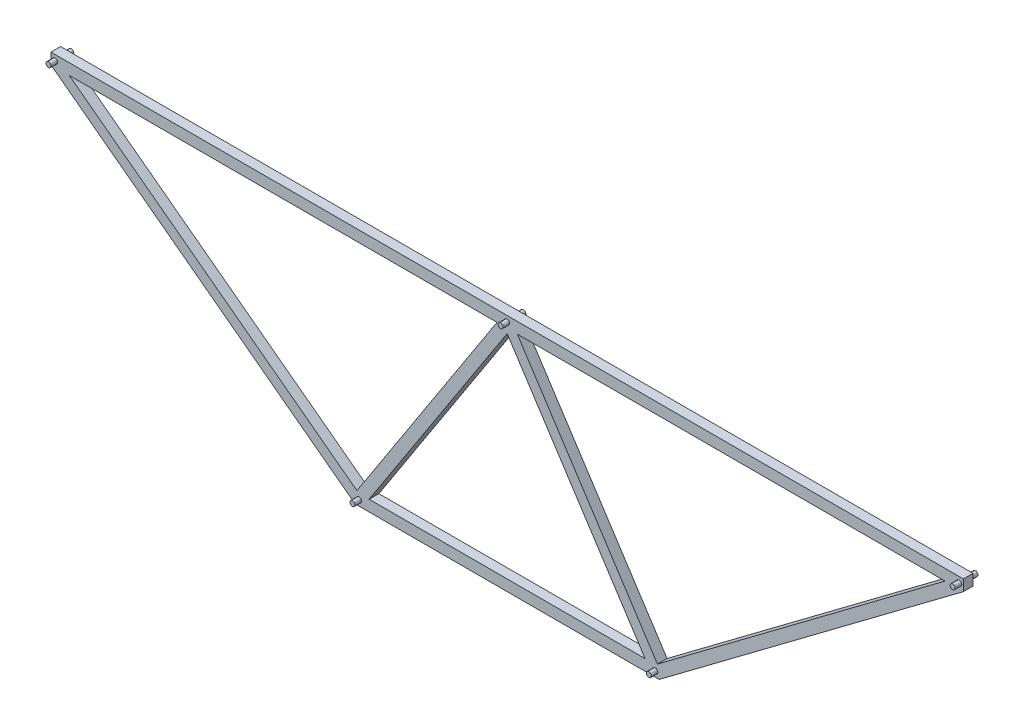
from build123d import *

# Parameters (mm, degrees)
BOSS_EXTRUDE2_DEPTH = 6.375
SKETCH3_R           = 3.3
BOSS_EXTRUDE3_DEPTH = 14.975


with BuildPart() as part:
    # Sketch1 → Boss-Extrude2 (new, symmetric)
    with BuildSketch(Plane.XY):
        Polygon((0, -7.245), (0, 0), (-600, 0), (-600, -14.49), (-591.306, -2.898), (-575.85, -14.49), (-13.344393946, -14.49), (-6.075978819, -3.298798486), align=None)
        Polygon((0, -20.546405114), (-3.933488865, -14.49), (-13.344393946, -14.49), (-197.595006689, -298.181244983), (-195.17, -300), (-181.498361341, -300), align=None)
        Polygon((-575.85, -14.49), (-600, -14.49), (-200, -314.49), (-200, -307.806399497), (-202.705205395, -306.049433921), (-200, -301.884220709), (-200, -300), (-198.776244152, -300), (-197.595006689, -298.181244983), align=None)
        Polygon((13.344393946, -14.49), (3.933488865, -14.49), (0, -20.546405114), (181.498361341, -300), (195.17, -300), (197.595006689, -298.181244983), align=None)
        Polygon((600, 0), (0, 0), (0, -7.245), (6.075978819, -3.298798486), (13.344393946, -14.49), (575.85, -14.49), (591.306, -2.898), (600, -14.49), align=None)
        Polygon((200, -314.49), (600, -14.49), (575.85, -14.49), (197.595006689, -298.181244983), (198.776244152, -300), (200, -300), (200, -301.884220709), (202.705205395, -306.049433921), (200, -307.806399497), align=None)
        Polygon((-200, -314.49), (200, -314.49), (196.629226576, -309.995635435), (190.553247757, -313.941836949), (181.498361341, -300), (-181.498361341, -300), (-190.553247757, -313.941836949), (-196.629226576, -309.995635435), align=None)
        Polygon((6.075978819, -3.298798486), (0, -7.245), (6.075978819, -11.191201514), (3.933488865, -14.49), (13.344393946, -14.49), align=None)
        Polygon((-6.075978819, -11.191201514), (0, -7.245), (-6.075978819, -3.298798486), (-13.344393946, -14.49), (-3.933488865, -14.49), align=None)
        Polygon((6.075978819, -11.191201514), (0, -7.245), (0, -14.49), (3.933488865, -14.49), align=None)
        Polygon((0, -14.49), (0, -7.245), (-6.075978819, -11.191201514), (-3.933488865, -14.49), align=None)
        Polygon((3.933488865, -14.49), (0, -14.49), (-3.933488865, -14.49), (0, -20.546405114), align=None)
        Polygon((198.776244152, -300), (197.595006689, -298.181244983), (195.17, -300), align=None)
        Polygon((200, -300), (198.776244152, -300), (200, -301.884220709), align=None)
        Polygon((200, -301.884220709), (200, -307.806399497), (202.705205395, -306.049433921), align=None)
        Polygon((196.629226576, -309.995635435), (200, -314.49), (200, -307.806399497), align=None)
        Polygon((196.629226576, -309.995635435), (200, -307.806399497), (200, -301.884220709), (198.776244152, -300), (195.17, -300), (191.306, -302.898), align=None)
        Polygon((190.553247757, -313.941836949), (196.629226576, -309.995635435), (191.306, -302.898), (195.17, -300), (181.498361341, -300), align=None)
        Polygon((575.85, -14.49), (600, -14.49), (591.306, -2.898), align=None)
        Polygon((-591.306, -2.898), (-600, -14.49), (-575.85, -14.49), align=None)
        Polygon((-191.306, -302.898), (-196.629226576, -309.995635435), (-190.553247757, -313.941836949), (-181.498361341, -300), (-195.17, -300), align=None)
        Polygon((-200, -307.806399497), (-200, -314.49), (-196.629226576, -309.995635435), align=None)
        Polygon((-202.705205395, -306.049433921), (-200, -307.806399497), (-200, -301.884220709), align=None)
        Polygon((-195.17, -300), (-197.595006689, -298.181244983), (-198.776244152, -300), align=None)
        Polygon((-200, -301.884220709), (-198.776244152, -300), (-200, -300), align=None)
        Polygon((-200, -301.884220709), (-200, -307.806399497), (-196.629226576, -309.995635435), (-191.306, -302.898), (-195.17, -300), (-198.776244152, -300), align=None)
    extrude(amount=BOSS_EXTRUDE2_DEPTH, both=True)

    # Sketch3 → Boss-Extrude3 (add, symmetric)
    with BuildSketch(Plane.XY):
        with Locations((0, -7.245)):
            Circle(SKETCH3_R)
        with Locations((-194.842755286, -307.245)):
            Circle(SKETCH3_R)
        with Locations((194.842755286, -307.245)):
            Circle(SKETCH3_R)
        with Locations((594.56625, -7.245)):
            Circle(SKETCH3_R)
        with Locations((-594.56625, -7.245)):
            Circle(SKETCH3_R)
    extrude(amount=BOSS_EXTRUDE3_DEPTH, both=True)


solid = part.part
